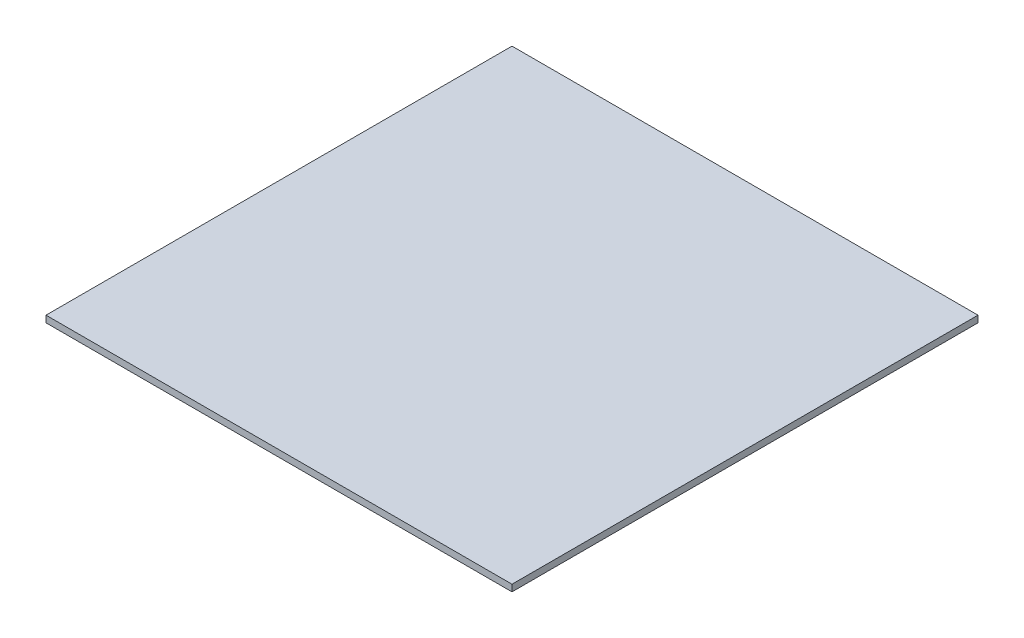
from build123d import *

# Parameters (mm, degrees)
SKETCH1_W           = 280
SKETCH1_H           = 280
BOSS_EXTRUDE1_DEPTH = 4


with BuildPart() as part:
    # Sketch1 → Boss-Extrude1 (new body)
    with BuildSketch(Plane(origin=(0, 0, 0), x_dir=(1, 0, 0), z_dir=(0, 1, 0))):
        with Locations((103.565287217, 97.00168087)):
            Rectangle(SKETCH1_W, SKETCH1_H)
    extrude(amount=BOSS_EXTRUDE1_DEPTH)


solid = part.part
